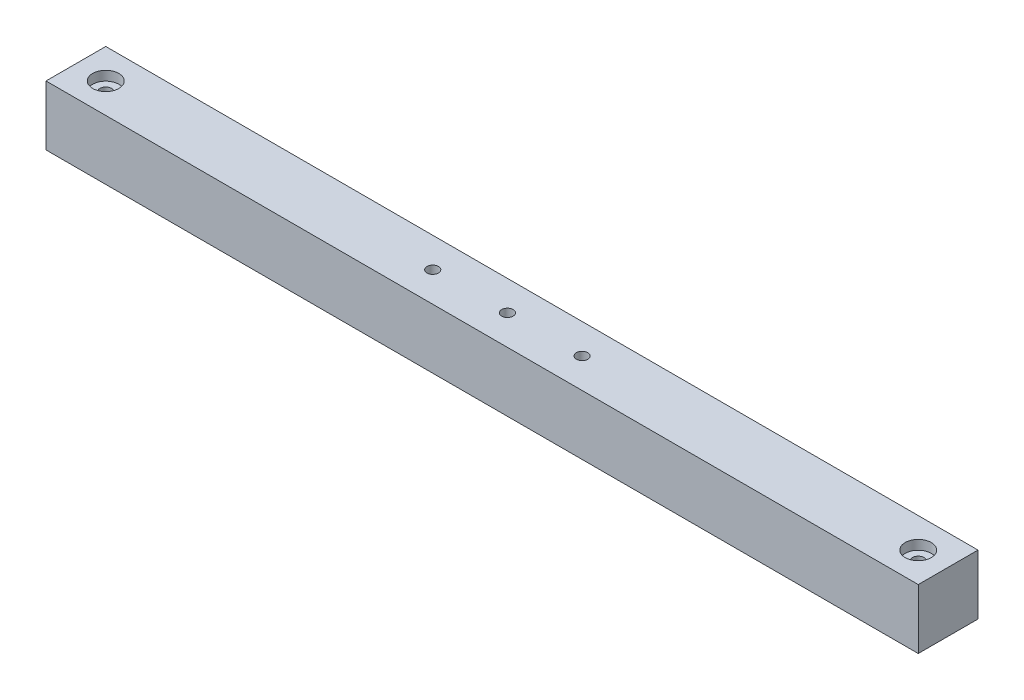
from build123d import *

# Parameters (mm, degrees)
SKETCH1_W           = 185.39968
SKETCH1_H           = 12.7
BOSS_EXTRUDE1_DEPTH = 12.7
SKETCH4_R           = 1.25
CUT_EXTRUDE3_DEPTH  = 187.267606803
SKETCH5_R           = 2.77495
CUT_EXTRUDE4_DEPTH  = 1.99898
SKETCH6_R           = 1.2192
CUT_EXTRUDE5_DEPTH  = 187.267606803


with BuildPart() as part:
    # Sketch1 → Boss-Extrude1 (new body)
    with BuildSketch(Plane(origin=(0, 0, 0), x_dir=(1, 0, 0), z_dir=(0, 1, 0))):
        with Locations((92.69984, 6.35)):
            Rectangle(SKETCH1_W, SKETCH1_H)
    extrude(amount=BOSS_EXTRUDE1_DEPTH)

    # Sketch4 → Cut-Extrude3 (cut, through all)
    with BuildSketch(Plane.XZ):
        with Locations(Location((179.04968, -6.35, 0), (0, 0, 270))):
            Circle(SKETCH4_R)
        with Locations(Location((6.35, -6.35, 0), (0, 0, 270))):
            Circle(SKETCH4_R)
    extrude(amount=-CUT_EXTRUDE3_DEPTH, mode=Mode.SUBTRACT)

    # Sketch5 → Cut-Extrude4 (cut)
    with BuildSketch(Plane.XZ.offset(-12.7)):
        with Locations(Location((179.04968, -6.35, 0), (0, 0, 270))):
            Circle(SKETCH5_R)
        with Locations(Location((6.35, -6.35, 0), (0, 0, 270))):
            Circle(SKETCH5_R)
    extrude(amount=CUT_EXTRUDE4_DEPTH, mode=Mode.SUBTRACT)

    # Sketch6 → Cut-Extrude5 (cut, through all)
    with BuildSketch(Plane(origin=(0, 12.7, 0), x_dir=(1, 0, 0), z_dir=(0, 1, 0))):
        with Locations(Location((91.7194, 6.35, 0), (0, 0, 270))):
            Circle(SKETCH6_R)
        with Locations(Location((107.5944, 6.35, 0), (0, 0, 270))):
            Circle(SKETCH6_R)
        with Locations(Location((75.8444, 6.35, 0), (0, 0, 270))):
            Circle(SKETCH6_R)
    extrude(amount=-CUT_EXTRUDE5_DEPTH, mode=Mode.SUBTRACT)


solid = part.part
